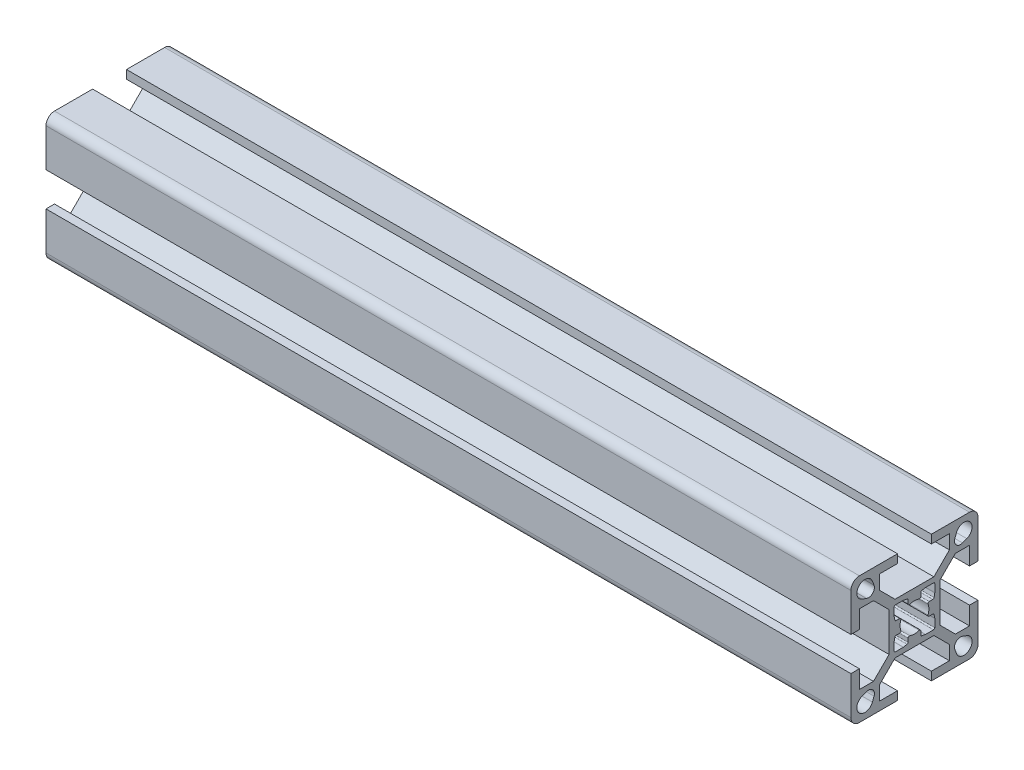
from build123d import *

# Parameters (mm, degrees)
BOSS_EXTRUDE1_DEPTH = 190


with BuildPart() as part:
    # Sketch1 → Boss-Extrude1 (new body)
    with BuildSketch(Plane(origin=(0, 0, 0), x_dir=(0, 0, -1), z_dir=(1, 0, 0))):
        with BuildLine():
            Line((-15, 13), (-15, 4))
            Line((-15, 4), (-13, 4))
            Line((-13, 4), (-13, 8.25))
            Line((-13, 8.25), (-9.664213562, 8.25))
            Line((-9.664213562, 8.25), (-6, 4.585786438))
            Line((-6, 4.585786438), (-6, -4.585786438))
            Line((-6, -4.585786438), (-9.664213562, -8.25))
            Line((-9.664213562, -8.25), (-13, -8.25))
            Line((-13, -8.25), (-13, -4))
            Line((-13, -4), (-15, -4))
            Line((-15, -4), (-15, -13))
            ThreePointArc((-15, -13), (-14.414213562, -14.414213562), (-13, -15))
            Line((-13, -15), (-4, -15))
            Line((-4, -15), (-4, -13))
            Line((-4, -13), (-8.25, -13))
            Line((-8.25, -13), (-8.25, -9.664213562))
            Line((-8.25, -9.664213562), (-4.585786438, -6))
            Line((-4.585786438, -6), (4.585786438, -6))
            Line((4.585786438, -6), (8.25, -9.664213562))
            Line((8.25, -9.664213562), (8.25, -13))
            Line((8.25, -13), (4, -13))
            Line((4, -13), (4, -15))
            Line((4, -15), (13, -15))
            ThreePointArc((13, -15), (14.414213562, -14.414213562), (15, -13))
            Line((15, -13), (15, -4))
            Line((15, -4), (13, -4))
            Line((13, -4), (13, -8.25))
            Line((13, -8.25), (9.664213562, -8.25))
            Line((9.664213562, -8.25), (6, -4.585786438))
            Line((6, -4.585786438), (6, 4.585786438))
            Line((6, 4.585786438), (9.664213562, 8.25))
            Line((9.664213562, 8.25), (13, 8.25))
            Line((13, 8.25), (13, 4))
            Line((13, 4), (15, 4))
            Line((15, 4), (15, 13))
            ThreePointArc((15, 13), (14.414213562, 14.414213562), (13, 15))
            Line((13, 15), (4, 15))
            Line((4, 15), (4, 13))
            Line((4, 13), (8.25, 13))
            Line((8.25, 13), (8.25, 9.664213562))
            Line((8.25, 9.664213562), (4.585786438, 6))
            Line((4.585786438, 6), (-4.585786438, 6))
            Line((-4.585786438, 6), (-8.25, 9.664213562))
            Line((-8.25, 9.664213562), (-8.25, 13))
            Line((-8.25, 13), (-4, 13))
            Line((-4, 13), (-4, 15))
            Line((-4, 15), (-13, 15))
            ThreePointArc((-13, 15), (-14.414213562, 14.414213562), (-15, 13))
        make_face()
        with BuildLine():
            Line((-9.539070071, 11.338915743), (-9.918883282, 12.361530981))
            ThreePointArc((-9.918883282, 12.361530981), (-13.043502884, 13.043502884), (-12.361530981, 9.918883282))
            Line((-12.361530981, 9.918883282), (-11.338915743, 9.539070071))
            ThreePointArc((-11.338915743, 9.539070071), (-9.861522369, 9.861522369), (-9.539070071, 11.338915743))
        make_face(mode=Mode.SUBTRACT)
        with BuildLine():
            Line((9.918883282, 12.361530981), (9.539070071, 11.338915743))
            ThreePointArc((9.539070071, 11.338915743), (9.861522369, 9.861522369), (11.338915743, 9.539070071))
            Line((11.338915743, 9.539070071), (12.361530981, 9.918883282))
            ThreePointArc((12.361530981, 9.918883282), (13.043502884, 13.043502884), (9.918883282, 12.361530981))
        make_face(mode=Mode.SUBTRACT)
        with BuildLine():
            Line((12.361530981, -9.918883282), (11.338915743, -9.539070071))
            ThreePointArc((11.338915743, -9.539070071), (9.861522369, -9.861522369), (9.539070071, -11.338915743))
            Line((9.539070071, -11.338915743), (9.918883282, -12.361530981))
            ThreePointArc((9.918883282, -12.361530981), (13.043502884, -13.043502884), (12.361530981, -9.918883282))
        make_face(mode=Mode.SUBTRACT)
        with BuildLine():
            Line((-11.338915743, -9.539070071), (-12.361530981, -9.918883282))
            ThreePointArc((-12.361530981, -9.918883282), (-13.043502884, -13.043502884), (-9.918883282, -12.361530981))
            Line((-9.918883282, -12.361530981), (-9.539070071, -11.338915743))
            ThreePointArc((-9.539070071, -11.338915743), (-9.861522369, -9.861522369), (-11.338915743, -9.539070071))
        make_face(mode=Mode.SUBTRACT)
        with BuildLine():
            Line((-4.8, -2.644433572), (-4.8, -4.5))
            ThreePointArc((-4.8, -4.5), (-4.712132034, -4.712132034), (-4.5, -4.8))
            Line((-4.5, -4.8), (-2.644433572, -4.8))
            ThreePointArc((-2.644433572, -4.8), (-2.615679847, -4.79861886), (-2.587190874, -4.794488155))
            Line((-2.587190874, -4.794488155), (-1.742757301, -4.630346896))
            ThreePointArc((-1.742757301, -4.630346896), (-1.568512625, -4.526682207), (-1.5, -4.335858741))
            Line((-1.5, -4.335858741), (-1.5, -3.5))
            ThreePointArc((-1.5, -3.5), (-1.374371458, -3.255879959), (-1.102702703, -3.216216216))
            ThreePointArc((-1.102702703, -3.216216216), (0, -3.4), (1.102702703, -3.216216216))
            ThreePointArc((1.102702703, -3.216216216), (1.374371458, -3.255879959), (1.5, -3.5))
            Line((1.5, -3.5), (1.5, -4.335858741))
            ThreePointArc((1.5, -4.335858741), (1.568512625, -4.526682207), (1.742757301, -4.630346896))
            Line((1.742757301, -4.630346896), (2.587190874, -4.794488155))
            ThreePointArc((2.587190874, -4.794488155), (2.615679847, -4.79861886), (2.644433572, -4.8))
            Line((2.644433572, -4.8), (4.5, -4.8))
            ThreePointArc((4.5, -4.8), (4.712132034, -4.712132034), (4.8, -4.5))
            Line((4.8, -4.5), (4.8, -2.644433572))
            ThreePointArc((4.8, -2.644433572), (4.79861886, -2.615679847), (4.794488155, -2.587190874))
            Line((4.794488155, -2.587190874), (4.630346896, -1.742757301))
            ThreePointArc((4.630346896, -1.742757301), (4.526682207, -1.568512625), (4.335858741, -1.5))
            Line((4.335858741, -1.5), (3.5, -1.5))
            ThreePointArc((3.5, -1.5), (3.255879959, -1.374371458), (3.216216216, -1.102702703))
            ThreePointArc((3.216216216, -1.102702703), (3.4, 0), (3.216216216, 1.102702703))
            ThreePointArc((3.216216216, 1.102702703), (3.255879959, 1.374371458), (3.5, 1.5))
            Line((3.5, 1.5), (4.335858741, 1.5))
            ThreePointArc((4.335858741, 1.5), (4.526682207, 1.568512625), (4.630346896, 1.742757301))
            Line((4.630346896, 1.742757301), (4.794488155, 2.587190874))
            ThreePointArc((4.794488155, 2.587190874), (4.79861886, 2.615679847), (4.8, 2.644433572))
            Line((4.8, 2.644433572), (4.8, 4.5))
            ThreePointArc((4.8, 4.5), (4.712132034, 4.712132034), (4.5, 4.8))
            Line((4.5, 4.8), (2.644433572, 4.8))
            ThreePointArc((2.644433572, 4.8), (2.615679847, 4.79861886), (2.587190874, 4.794488155))
            Line((2.587190874, 4.794488155), (1.742757301, 4.630346896))
            ThreePointArc((1.742757301, 4.630346896), (1.568512625, 4.526682207), (1.5, 4.335858741))
            Line((1.5, 4.335858741), (1.5, 3.5))
            ThreePointArc((1.5, 3.5), (1.374371458, 3.255879959), (1.102702703, 3.216216216))
            ThreePointArc((1.102702703, 3.216216216), (0, 3.4), (-1.102702703, 3.216216216))
            ThreePointArc((-1.102702703, 3.216216216), (-1.374371458, 3.255879959), (-1.5, 3.5))
            Line((-1.5, 3.5), (-1.5, 4.335858741))
            ThreePointArc((-1.5, 4.335858741), (-1.568512625, 4.526682207), (-1.742757301, 4.630346896))
            Line((-1.742757301, 4.630346896), (-2.587190874, 4.794488155))
            ThreePointArc((-2.587190874, 4.794488155), (-2.615679847, 4.79861886), (-2.644433572, 4.8))
            Line((-2.644433572, 4.8), (-4.5, 4.8))
            ThreePointArc((-4.5, 4.8), (-4.712132034, 4.712132034), (-4.8, 4.5))
            Line((-4.8, 4.5), (-4.8, 2.644433572))
            ThreePointArc((-4.8, 2.644433572), (-4.79861886, 2.615679847), (-4.794488155, 2.587190874))
            Line((-4.794488155, 2.587190874), (-4.630346896, 1.742757301))
            ThreePointArc((-4.630346896, 1.742757301), (-4.526682207, 1.568512625), (-4.335858741, 1.5))
            Line((-4.335858741, 1.5), (-3.5, 1.5))
            ThreePointArc((-3.5, 1.5), (-3.255879959, 1.374371458), (-3.216216216, 1.102702703))
            ThreePointArc((-3.216216216, 1.102702703), (-3.4, 0), (-3.216216216, -1.102702703))
            ThreePointArc((-3.216216216, -1.102702703), (-3.255879959, -1.374371458), (-3.5, -1.5))
            Line((-3.5, -1.5), (-4.335858741, -1.5))
            ThreePointArc((-4.335858741, -1.5), (-4.526682207, -1.568512625), (-4.630346896, -1.742757301))
            Line((-4.630346896, -1.742757301), (-4.794488155, -2.587190874))
            ThreePointArc((-4.794488155, -2.587190874), (-4.79861886, -2.615679847), (-4.8, -2.644433572))
        make_face(mode=Mode.SUBTRACT)
    extrude(amount=BOSS_EXTRUDE1_DEPTH)


solid = part.part
